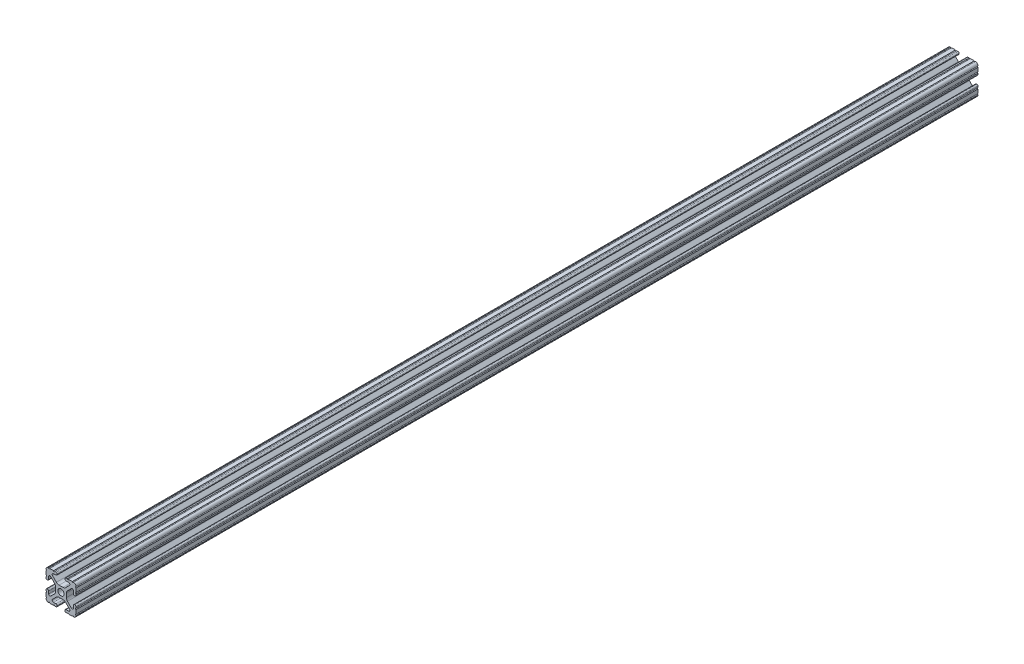
from build123d import *

# Parameters (mm, degrees)
SKETCH1_R           = 2.6035
BOSS_EXTRUDE1_DEPTH = 381


with BuildPart() as part:
    # Sketch1 → Boss-Extrude1 (new, symmetric)
    with BuildSketch(Plane.XY):
        with BuildLine():
            Line((-7.179650497, -8.645192506), (-3.952270251, -5.423690499))
            ThreePointArc((-3.952270251, -5.423690499), (-2.922936451, -4.736929036), (-1.709253557, -4.4958))
            Line((-1.709253557, -4.4958), (1.709253557, -4.4958))
            ThreePointArc((1.709253557, -4.4958), (2.922936451, -4.736929036), (3.952270251, -5.423690499))
            Line((3.952270251, -5.423690499), (7.179650497, -8.645192506))
            ThreePointArc((7.179650497, -8.645192506), (7.41473083, -9.822813117), (6.416408329, -10.4902))
            Line((6.416408329, -10.4902), (4.287512407, -10.4902))
            ThreePointArc((4.287512407, -10.4902), (3.54574862, -10.79744862), (3.2385, -11.539212407))
            Line((3.2385, -11.539212407), (3.2385, -11.650987593))
            ThreePointArc((3.2385, -11.650987593), (3.54574862, -12.39275138), (4.287512407, -12.7))
            Line((4.287512407, -12.7), (5.317126718, -12.7))
            ThreePointArc((5.317126718, -12.7), (5.825126718, -12.192), (6.333126718, -12.7))
            Line((6.333126718, -12.7), (9.550443118, -12.7))
            ThreePointArc((9.550443118, -12.7), (10.058366869, -12.192000006), (10.566443095, -12.699847501))
            ThreePointArc((10.566443095, -12.699847501), (12.082537762, -12.08250727), (12.699846982, -10.566399977))
            ThreePointArc((12.699846982, -10.566399977), (12.192000006, -10.058323491), (12.7, -9.5504))
            Line((12.7, -9.5504), (12.7, -6.3330836))
            ThreePointArc((12.7, -6.3330836), (12.192, -5.8250836), (12.7, -5.3170836))
            Line((12.7, -5.3170836), (12.7, -4.287469289))
            ThreePointArc((12.7, -4.287469289), (12.39275138, -3.545705502), (11.650987593, -3.238456882))
            Line((11.650987593, -3.238456882), (11.539212407, -3.238456882))
            ThreePointArc((11.539212407, -3.238456882), (10.79744862, -3.545705502), (10.4902, -4.287469289))
            Line((10.4902, -4.287469289), (10.4902, -6.402089023))
            ThreePointArc((10.4902, -6.402089023), (9.856505071, -7.351067942), (8.737131347, -7.129408934))
            Line((8.737131347, -7.129408934), (5.441005833, -3.840816462))
            ThreePointArc((5.441005833, -3.840816462), (4.750877967, -2.809883091), (4.5085, -1.593185507))
            Line((4.5085, -1.593185507), (4.5085, 1.593185507))
            ThreePointArc((4.5085, 1.593185507), (4.750877967, 2.809883091), (5.441005833, 3.840816462))
            Line((5.441005833, 3.840816462), (8.737131347, 7.129408934))
            ThreePointArc((8.737131347, 7.129408934), (9.856505071, 7.351067942), (10.4902, 6.402089023))
            Line((10.4902, 6.402089023), (10.4902, 4.287469289))
            ThreePointArc((10.4902, 4.287469289), (10.79744862, 3.545705502), (11.539212407, 3.238456882))
            Line((11.539212407, 3.238456882), (11.650987593, 3.238456882))
            ThreePointArc((11.650987593, 3.238456882), (12.39275138, 3.545705502), (12.7, 4.287469289))
            Line((12.7, 4.287469289), (12.7, 5.3170836))
            ThreePointArc((12.7, 5.3170836), (12.192, 5.8250836), (12.7, 6.3330836))
            Line((12.7, 6.3330836), (12.7, 9.5504))
            ThreePointArc((12.7, 9.5504), (12.192000006, 10.058323491), (12.699846982, 10.566399977))
            ThreePointArc((12.699846982, 10.566399977), (12.082537762, 12.08250727), (10.566443095, 12.699847501))
            ThreePointArc((10.566443095, 12.699847501), (10.058366869, 12.192000006), (9.550443118, 12.7))
            Line((9.550443118, 12.7), (6.333126718, 12.7))
            ThreePointArc((6.333126718, 12.7), (5.825126718, 12.192), (5.317126718, 12.7))
            Line((5.317126718, 12.7), (4.287512407, 12.7))
            ThreePointArc((4.287512407, 12.7), (3.54574862, 12.39275138), (3.2385, 11.650987593))
            Line((3.2385, 11.650987593), (3.2385, 11.539212407))
            ThreePointArc((3.2385, 11.539212407), (3.54574862, 10.79744862), (4.287512407, 10.4902))
            Line((4.287512407, 10.4902), (6.476788598, 10.4902))
            ThreePointArc((6.476788598, 10.4902), (7.432222385, 9.85140422), (7.207036008, 8.724370562))
            Line((7.207036008, 8.724370562), (3.898272566, 5.423169045))
            ThreePointArc((3.898272566, 5.423169045), (2.869120213, 4.736787962), (1.655778399, 4.4958))
            Line((1.655778399, 4.4958), (-1.655778399, 4.4958))
            ThreePointArc((-1.655778399, 4.4958), (-2.869120213, 4.736787962), (-3.898272566, 5.423169045))
            Line((-3.898272566, 5.423169045), (-7.207036008, 8.724370562))
            ThreePointArc((-7.207036008, 8.724370562), (-7.432222385, 9.85140422), (-6.476788598, 10.4902))
            Line((-6.476788598, 10.4902), (-4.287512407, 10.4902))
            ThreePointArc((-4.287512407, 10.4902), (-3.54574862, 10.79744862), (-3.2385, 11.539212407))
            Line((-3.2385, 11.539212407), (-3.2385, 11.650987593))
            ThreePointArc((-3.2385, 11.650987593), (-3.54574862, 12.39275138), (-4.287512407, 12.7))
            Line((-4.287512407, 12.7), (-5.317126718, 12.7))
            ThreePointArc((-5.317126718, 12.7), (-5.825126718, 12.192), (-6.333126718, 12.7))
            Line((-6.333126718, 12.7), (-9.550443118, 12.7))
            ThreePointArc((-9.550443118, 12.7), (-10.058366869, 12.192000006), (-10.566443095, 12.699847501))
            ThreePointArc((-10.566443095, 12.699847501), (-12.082537762, 12.08250727), (-12.699846982, 10.566399977))
            ThreePointArc((-12.699846982, 10.566399977), (-12.192000006, 10.058323491), (-12.7, 9.5504))
            Line((-12.7, 9.5504), (-12.7, 6.3330836))
            ThreePointArc((-12.7, 6.3330836), (-12.192, 5.8250836), (-12.7, 5.3170836))
            Line((-12.7, 5.3170836), (-12.7, 4.287469289))
            ThreePointArc((-12.7, 4.287469289), (-12.39275138, 3.545705502), (-11.650987593, 3.238456882))
            Line((-11.650987593, 3.238456882), (-11.539212407, 3.238456882))
            ThreePointArc((-11.539212407, 3.238456882), (-10.79744862, 3.545705502), (-10.4902, 4.287469289))
            Line((-10.4902, 4.287469289), (-10.4902, 6.402089023))
            ThreePointArc((-10.4902, 6.402089023), (-9.856505071, 7.351067942), (-8.737131347, 7.129408934))
            Line((-8.737131347, 7.129408934), (-5.441005833, 3.840816462))
            ThreePointArc((-5.441005833, 3.840816462), (-4.750877967, 2.809883091), (-4.5085, 1.593185507))
            Line((-4.5085, 1.593185507), (-4.5085, -1.593185507))
            ThreePointArc((-4.5085, -1.593185507), (-4.750877967, -2.809883091), (-5.441005833, -3.840816462))
            Line((-5.441005833, -3.840816462), (-8.737131347, -7.129408934))
            ThreePointArc((-8.737131347, -7.129408934), (-9.856505071, -7.351067942), (-10.4902, -6.402089023))
            Line((-10.4902, -6.402089023), (-10.4902, -4.287469289))
            ThreePointArc((-10.4902, -4.287469289), (-10.79744862, -3.545705502), (-11.539212407, -3.238456882))
            Line((-11.539212407, -3.238456882), (-11.650987593, -3.238456882))
            ThreePointArc((-11.650987593, -3.238456882), (-12.39275138, -3.545705502), (-12.7, -4.287469289))
            Line((-12.7, -4.287469289), (-12.7, -5.3170836))
            ThreePointArc((-12.7, -5.3170836), (-12.192, -5.8250836), (-12.7, -6.3330836))
            Line((-12.7, -6.3330836), (-12.7, -9.5504))
            ThreePointArc((-12.7, -9.5504), (-12.192000006, -10.058323491), (-12.699846982, -10.566399977))
            ThreePointArc((-12.699846982, -10.566399977), (-12.082537762, -12.08250727), (-10.566443095, -12.699847501))
            ThreePointArc((-10.566443095, -12.699847501), (-10.058366869, -12.192000006), (-9.550443118, -12.7))
            Line((-9.550443118, -12.7), (-6.333126718, -12.7))
            ThreePointArc((-6.333126718, -12.7), (-5.825126718, -12.192), (-5.317126718, -12.7))
            Line((-5.317126718, -12.7), (-4.287512407, -12.7))
            ThreePointArc((-4.287512407, -12.7), (-3.54574862, -12.39275138), (-3.2385, -11.650987593))
            Line((-3.2385, -11.650987593), (-3.2385, -11.539212407))
            ThreePointArc((-3.2385, -11.539212407), (-3.54574862, -10.79744862), (-4.287512407, -10.4902))
            Line((-4.287512407, -10.4902), (-6.416408329, -10.4902))
            ThreePointArc((-6.416408329, -10.4902), (-7.41473083, -9.822813117), (-7.179650497, -8.645192506))
        make_face()
        Circle(SKETCH1_R, mode=Mode.SUBTRACT)
    extrude(amount=BOSS_EXTRUDE1_DEPTH, both=True)


solid = part.part
